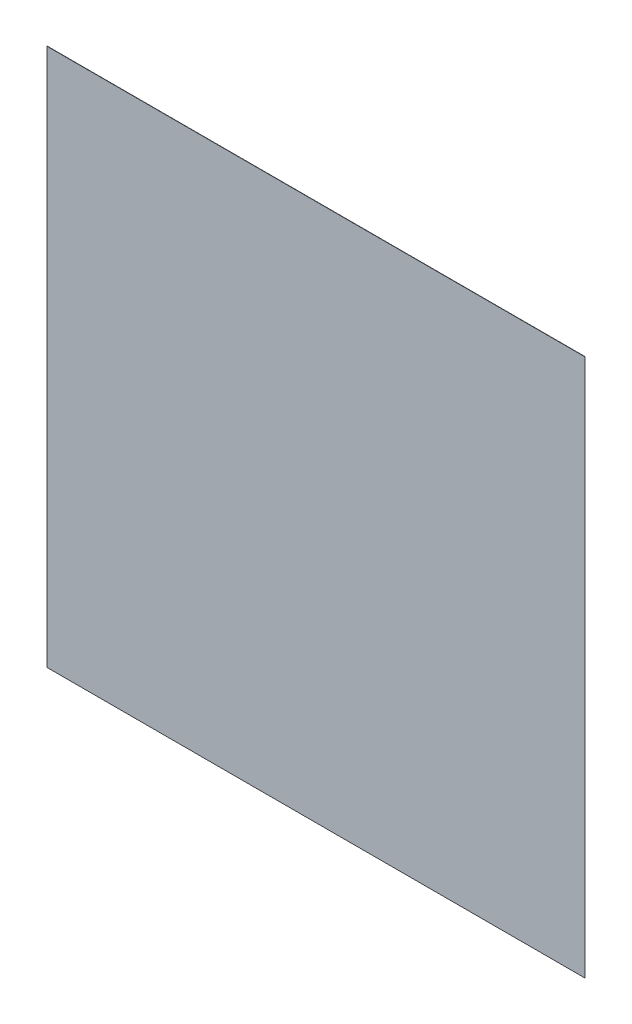
from build123d import *

# Parameters (mm, degrees)
SKETCH1_W           = 30
SKETCH1_H           = 30
BOSS_EXTRUDE1_DEPTH = 0.015


with BuildPart() as part:
    # Sketch1 → Boss-Extrude1 (new body)
    with BuildSketch(Plane.XY):
        Rectangle(SKETCH1_W, SKETCH1_H)
    extrude(amount=BOSS_EXTRUDE1_DEPTH)


solid = part.part
